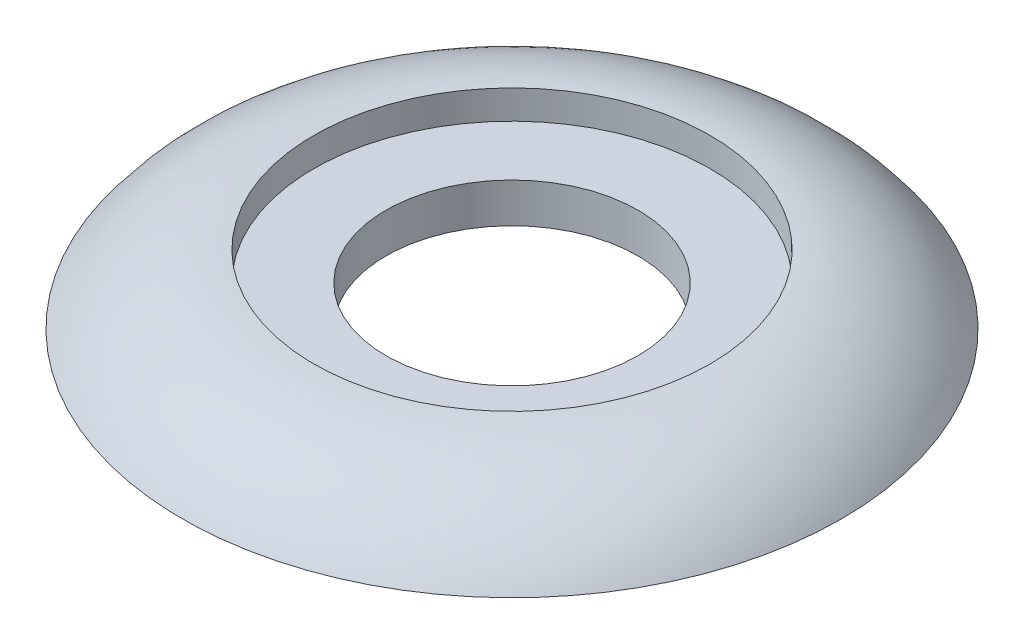
from build123d import *


with BuildPart() as part:
    # Sketch1 → Revolve1 (revolve)
    with BuildSketch(Plane.XY):
        with BuildLine():
            Line((4.445, 0), (11.6205, 0))
            ThreePointArc((11.6205, 0), (9.597969061, 1.773631354), (6.985, 2.413))
            Line((6.985, 2.413), (6.985, 1.397))
            Line((6.985, 1.397), (4.445, 1.397))
            Line((4.445, 1.397), (4.445, 0))
        make_face()
    revolve(axis=Axis((0, -397.382429867, 0), (0, 1, 0)))


solid = part.part
